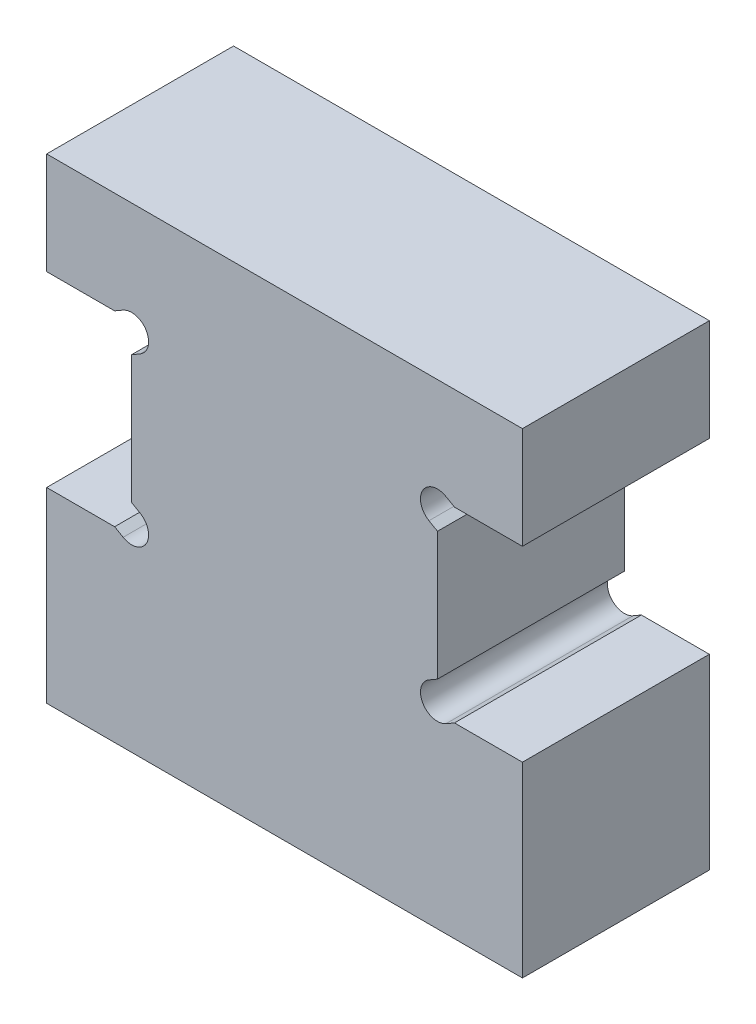
from build123d import *

# Parameters (mm, degrees)
BOSS_EXTRUDE1_DEPTH   = 11
M5_TAPPED_HOLE1_D     = 4.2
M5_TAPPED_HOLE1_DEPTH = 16.7381927
M5_TAPPED_HOLE1_TIP   = 1.2618073


with BuildPart() as part:
    # Sketch1 → Boss-Extrude1 (new body)
    with BuildSketch(Plane.XY):
        with BuildLine():
            Line((14, -15.93967455), (-14, -15.93967455))
            Line((-14, -15.93967455), (-14, -4.93967455))
            Line((-14, -4.93967455), (-10, -4.93967455))
            Line((-10, -4.93967455), (-9.5, -5.228349685))
            ThreePointArc((-9.5, -5.228349685), (-8.133974596, -4.862324281), (-8.5, -3.496298877))
            Line((-8.5, -3.496298877), (-9, -3.207623743))
            Line((-9, -3.207623743), (-9, 4.328274642))
            Line((-9, 4.328274642), (-8.5, 4.616949777))
            ThreePointArc((-8.5, 4.616949777), (-8.133974596, 5.982975181), (-9.5, 6.349000584))
            Line((-9.5, 6.349000584), (-10, 6.06032545))
            Line((-10, 6.06032545), (-14, 6.06032545))
            Line((-14, 6.06032545), (-14, 12.06032545))
            Line((-14, 12.06032545), (14, 12.06032545))
            Line((14, 12.06032545), (14, 6.06032545))
            Line((14, 6.06032545), (10, 6.06032545))
            Line((10, 6.06032545), (9.5, 6.349000584))
            ThreePointArc((9.5, 6.349000584), (8.133974596, 5.982975181), (8.5, 4.616949777))
            Line((8.5, 4.616949777), (9, 4.328274642))
            Line((9, 4.328274642), (9, -3.207623743))
            Line((9, -3.207623743), (8.5, -3.496298877))
            ThreePointArc((8.5, -3.496298877), (8.133974596, -4.862324281), (9.5, -5.228349685))
            Line((9.5, -5.228349685), (10, -4.93967455))
            Line((10, -4.93967455), (14, -4.93967455))
            Line((14, -4.93967455), (14, -15.93967455))
        make_face()
    extrude(amount=BOSS_EXTRUDE1_DEPTH)

    # M5 Tapped Hole1
    with Locations(Plane(origin=(0, -15.93967455, 0), x_dir=(-1, 0, 0), z_dir=(0, -1, 0))):
        with Locations((0, -5.5)):
            Hole(M5_TAPPED_HOLE1_D / 2, depth=M5_TAPPED_HOLE1_DEPTH)
            with Locations((0, 0, -(M5_TAPPED_HOLE1_DEPTH + M5_TAPPED_HOLE1_TIP / 2))):  # 118° drill point
                Cone(0, M5_TAPPED_HOLE1_D / 2, M5_TAPPED_HOLE1_TIP, mode=Mode.SUBTRACT)


solid = part.part
